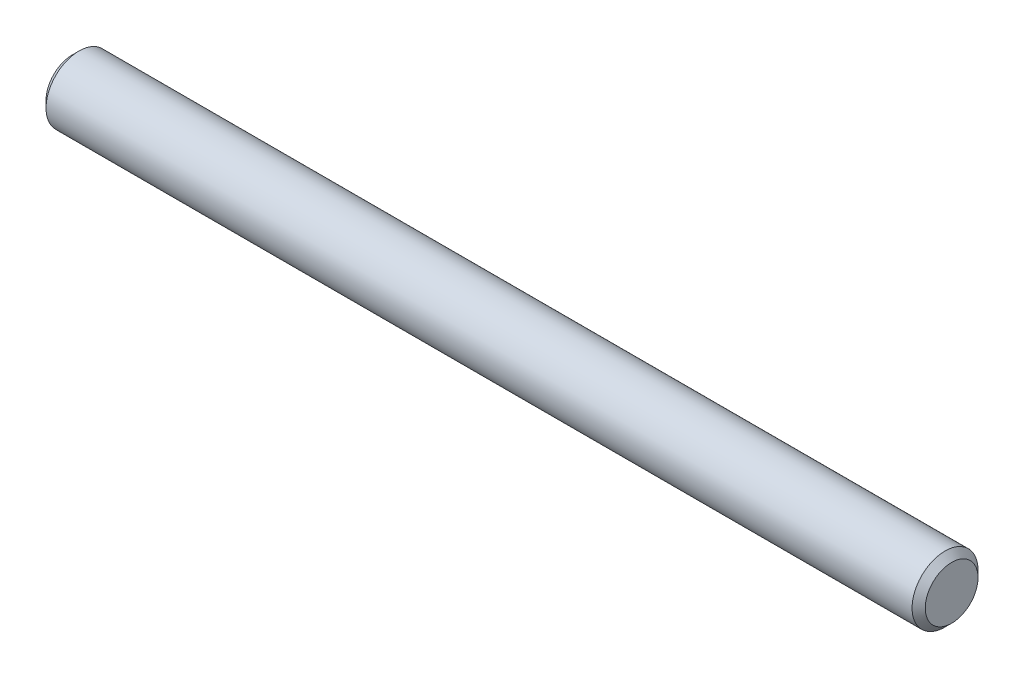
from build123d import *

# Parameters (mm, degrees)
EXTRUDE1_DEPTH      = 31.75
EXTRUDE1_DEPTH_BACK = 31.75
SKETCH2_R           = 2.38125
CHAMFER1_SIZE       = 0.47625


with BuildPart() as part:
    # Sketch2 → Extrude1 (new, two sides: drawn at the far end of the back side and taken through both)
    with BuildSketch(Plane(origin=(0, 0, 0), x_dir=(0, 0, -1), z_dir=(1, 0, 0)).offset(-EXTRUDE1_DEPTH_BACK)):
        Circle(SKETCH2_R)
    extrude(amount=EXTRUDE1_DEPTH + EXTRUDE1_DEPTH_BACK)

    # Chamfer1
    chamfer1_edges = [part.edges().sort_by_distance(p)[0] for p in [
        (-31.75, 0, 2.38125),
        (31.75, 0, 2.38125),
    ]]
    chamfer(chamfer1_edges, length=CHAMFER1_SIZE)


solid = part.part
